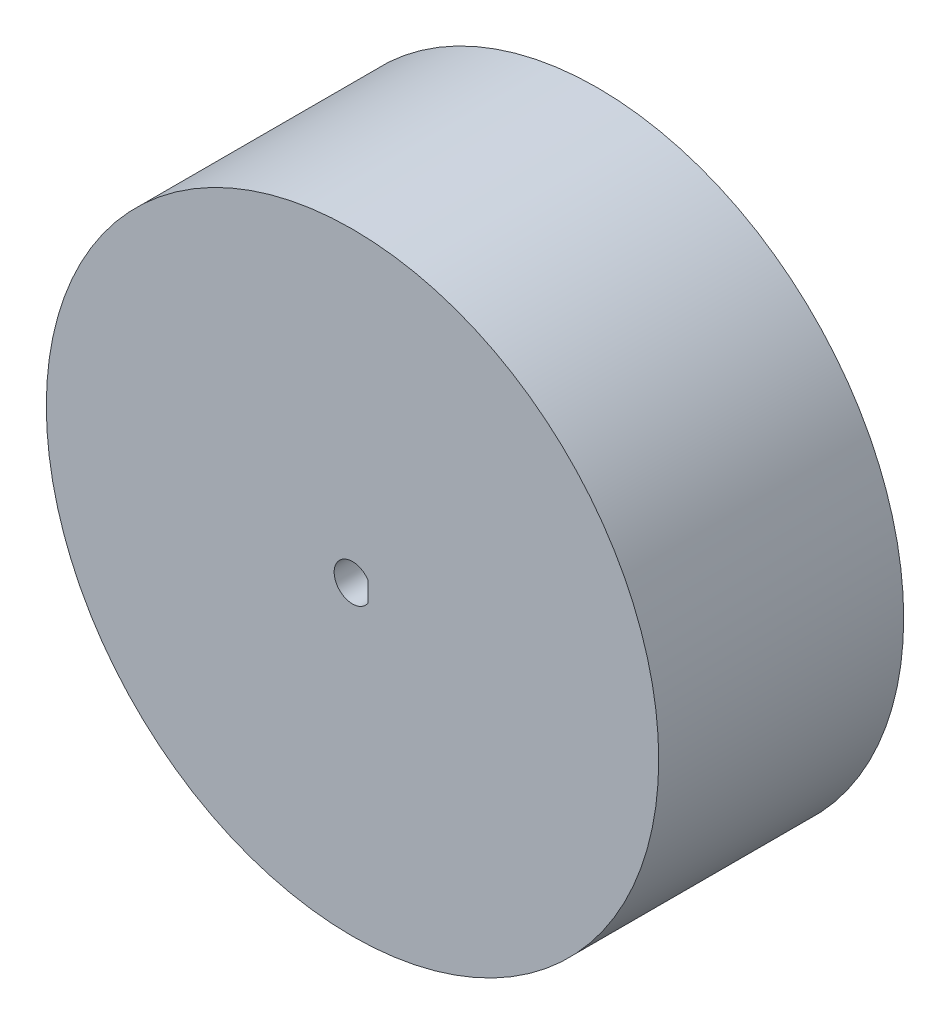
from build123d import *

# Parameters (mm, degrees)
SKETCH_1_R      = 50
EXTRUDE_1_DEPTH = 40


with BuildPart() as part:
    # 스케치1 → 보스-돌출1 (new body)
    with BuildSketch(Plane.XY):
        with Locations((0, -7)):
            Circle(SKETCH_1_R)
        with BuildLine():
            Line((2.5, -5.341687605), (2.5, -8.658312395))
            ThreePointArc((2.5, -8.658312395), (-3, -7), (2.5, -5.341687605))
        make_face(mode=Mode.SUBTRACT)
    extrude(amount=EXTRUDE_1_DEPTH)


solid = part.part
